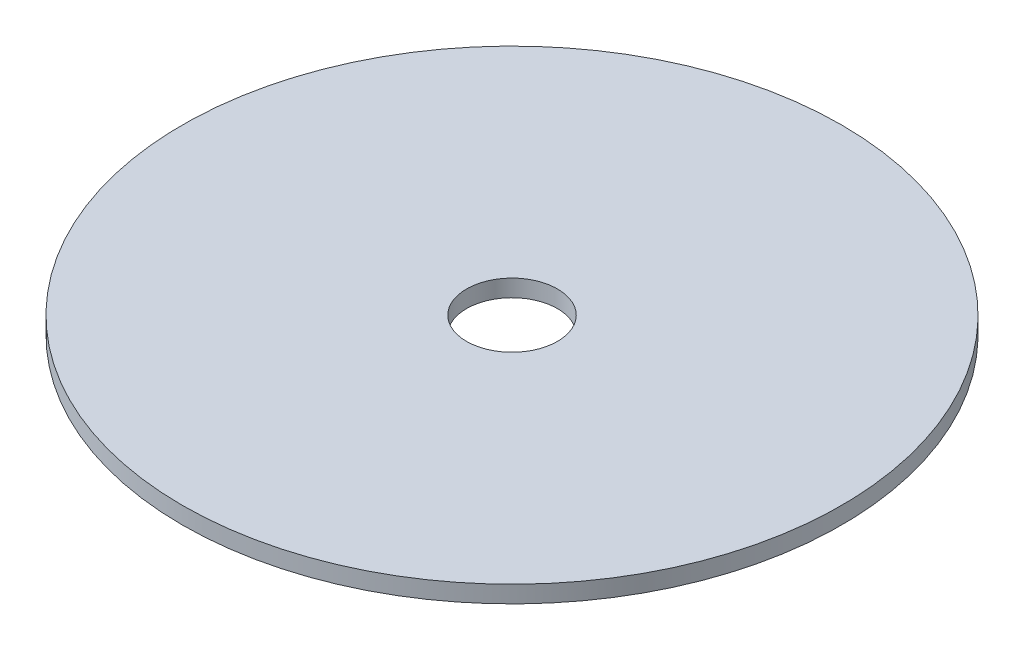
from build123d import *

# Parameters (mm, degrees)
SKETCH1_R           = 58
SKETCH1_R_2         = 8
BOSS_EXTRUDE1_DEPTH = 1.5


with BuildPart() as part:
    # Sketch1 → Boss-Extrude1 (new, symmetric)
    with BuildSketch(Plane(origin=(0, 0, 0), x_dir=(1, 0, 0), z_dir=(0, 1, 0))):
        with Locations(Location((0, 0, 0), (0, 0, 270))):
            Circle(SKETCH1_R)
        with Locations(Location((0, 0, 0), (0, 0, 270))):
            Circle(SKETCH1_R_2, mode=Mode.SUBTRACT)
    extrude(amount=BOSS_EXTRUDE1_DEPTH, both=True)


solid = part.part
